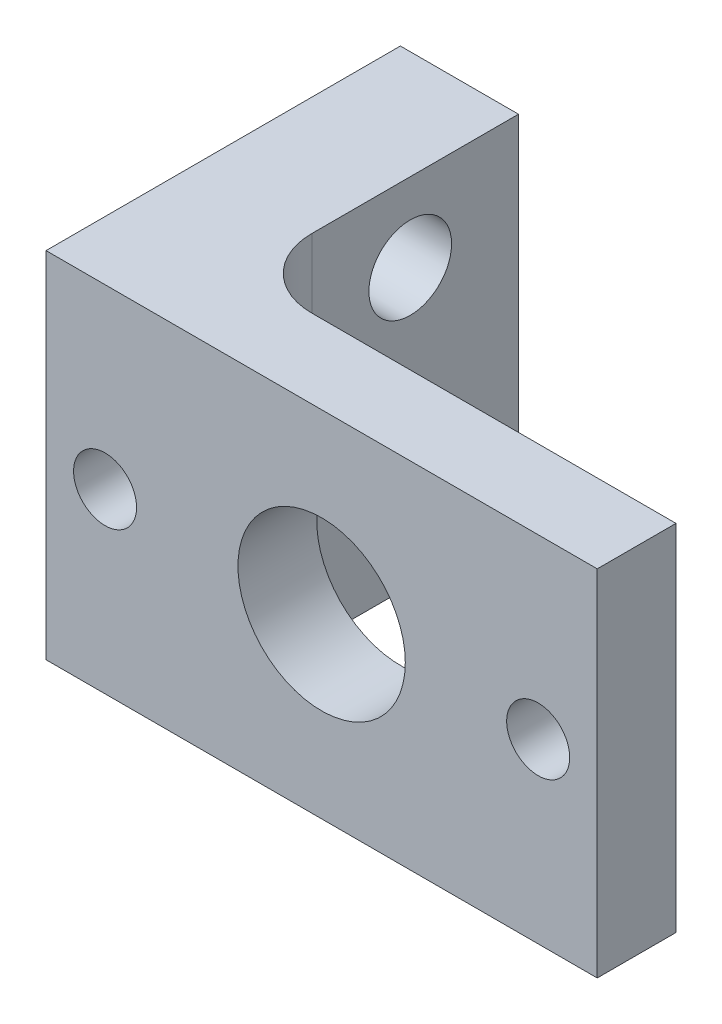
from build123d import *

# Parameters (mm, degrees)
BOSS_EXTRUDE1_DEPTH = 18
SKETCH4_R           = 1.6
CUT_EXTRUDE2_DEPTH  = 38.841775857
FILLET1_R           = 3.5
SKETCH7_R           = 2.1
CUT_EXTRUDE5_DEPTH  = 6
SKETCH8_R           = 4.25
CUT_EXTRUDE6_DEPTH  = 38.841775857


with BuildPart() as part:
    # Sketch1 → Boss-Extrude1 (new body)
    with BuildSketch(Plane(origin=(0, 0, 0), x_dir=(1, 0, 0), z_dir=(0, 1, 0))):
        Polygon((0, 18), (0, 0), (28, 0), (28, 4), (6, 4), (6, 18), align=None)
    extrude(amount=BOSS_EXTRUDE1_DEPTH)

    # Sketch4 → Cut-Extrude2 (cut, through all)
    with BuildSketch(Plane.XY):
        with Locations((25, 9)):
            Circle(SKETCH4_R)
        with Locations((3, 9)):
            Circle(SKETCH4_R)
    extrude(amount=-CUT_EXTRUDE2_DEPTH, mode=Mode.SUBTRACT)

    # Fillet1
    fillet1_edges = [part.edges().sort_by_distance(p)[0] for p in [
        (6, 9, -4),
    ]]
    fillet(fillet1_edges, radius=FILLET1_R)

    # Sketch7 → Cut-Extrude5 (cut)
    with BuildSketch(Plane(origin=(6, 0, 0), x_dir=(0, 0, -1), z_dir=(1, 0, 0))):
        with Locations((12.5, 14)):
            Circle(SKETCH7_R)
        with Locations(Location((12.5, 4, 0), (0, 0, 180))):
            Circle(SKETCH7_R)
    extrude(amount=-CUT_EXTRUDE5_DEPTH, mode=Mode.SUBTRACT)

    # Sketch8 → Cut-Extrude6 (cut, through all)
    with BuildSketch(Plane.XY):
        with Locations((14, 9)):
            Circle(SKETCH8_R)
    extrude(amount=-CUT_EXTRUDE6_DEPTH, mode=Mode.SUBTRACT)


solid = part.part
